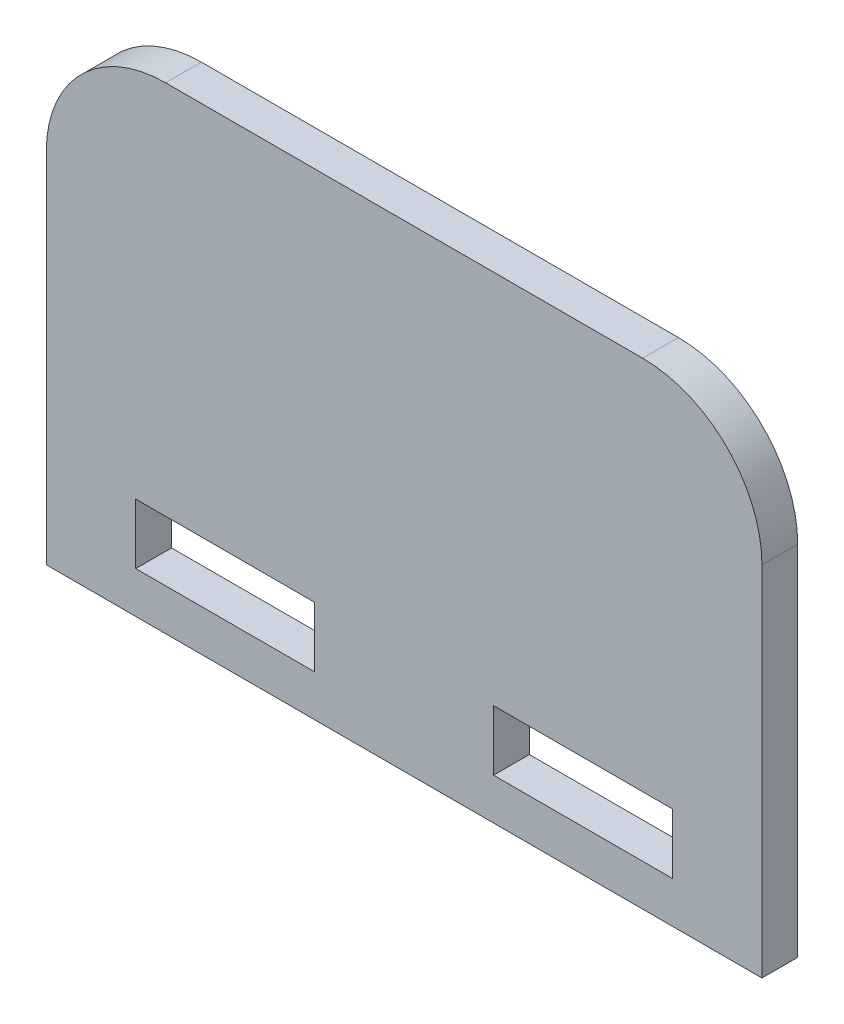
from build123d import *

# Parameters (mm, degrees)
ESQUISSE1_W        = 15
ESQUISSE1_H        = 5.05
BOSS_EXTRU_1_DEPTH = 3


with BuildPart() as part:
    # Esquisse1 → Boss.-Extru.1 (new body)
    with BuildSketch(Plane.XY):
        with BuildLine():
            Line((-20, 20), (20, 20))
            ThreePointArc((20, 20), (27.071067812, 17.071067812), (30, 10))
            Line((30, 10), (30, -20))
            Line((30, -20), (-30, -20))
            Line((-30, -20), (-30, 10))
            ThreePointArc((-30, 10), (-27.071067812, 17.071067812), (-20, 20))
        make_face()
        with Locations((15, -14)):
            Rectangle(ESQUISSE1_W, ESQUISSE1_H, mode=Mode.SUBTRACT)
        with Locations((-15, -14)):
            Rectangle(ESQUISSE1_W, ESQUISSE1_H, mode=Mode.SUBTRACT)
    extrude(amount=BOSS_EXTRU_1_DEPTH)


solid = part.part
